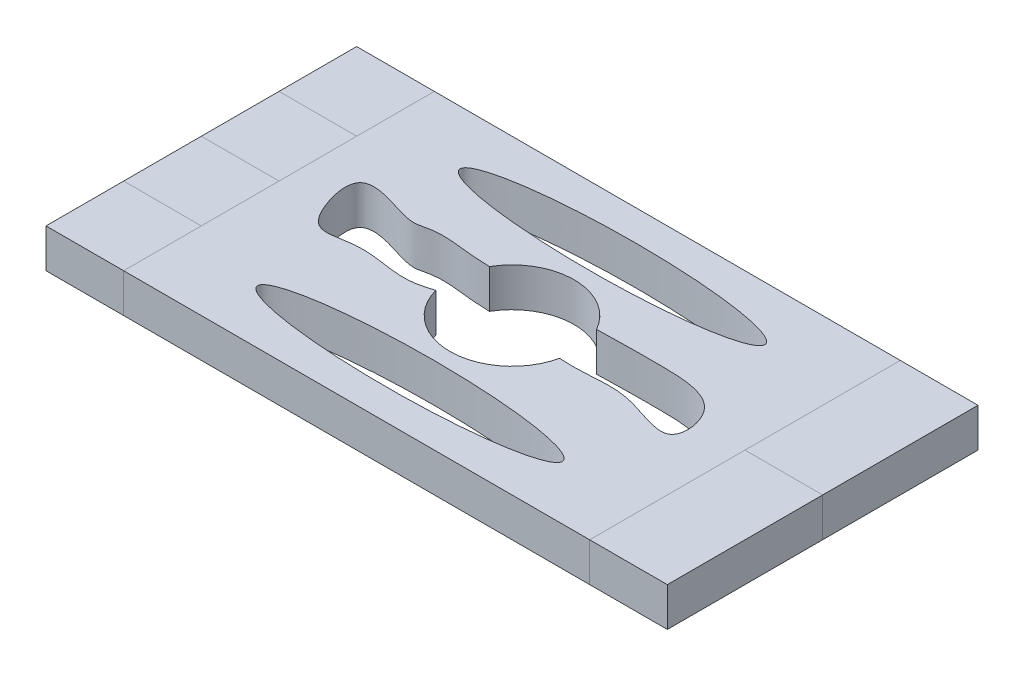
from build123d import *

# Parameters (mm, degrees)
SKETCH1_W           = 38.1
SKETCH1_H           = 25.4
SKETCH1_R           = 5.08
BOSS_EXTRUDE1_DEPTH = 3.175
SKETCH2_W           = 6.35
SKETCH2_H           = 3.175
BOSS_EXTRUDE3_DEPTH = 6.35
SKETCH2_4_W         = 6.35
SKETCH2_4_H         = 3.175
BOSS_EXTRUDE4_DEPTH = 6.35
SKETCH2_6_W         = 6.35
SKETCH2_6_H         = 3.175
BOSS_EXTRUDE6_DEPTH = 6.35
SKETCH2_7_W         = 6.35
SKETCH2_7_H         = 3.175
BOSS_EXTRUDE7_DEPTH = 6.35
SKETCH4_W           = 12.7
SKETCH4_H           = 3.175
BOSS_EXTRUDE8_DEPTH = 6.35
SKETCH4_3_W         = 12.7
SKETCH4_3_H         = 3.175
BOSS_EXTRUDE9_DEPTH = 6.35
SKETCH9_RX          = 12.451877405
SKETCH9_RY          = 1.917472524
CUT_EXTRUDE5_DEPTH  = 29.575
CUT_EXTRUDE7_DEPTH  = 29.575000056


with BuildPart() as part:
    # Sketch1 → Boss-Extrude1 (new body)
    with BuildSketch(Plane(origin=(0, 0, 0), x_dir=(1, 0, 0), z_dir=(0, 1, 0))):
        Rectangle(SKETCH1_W, SKETCH1_H)
        Circle(SKETCH1_R, mode=Mode.SUBTRACT)
    extrude(amount=BOSS_EXTRUDE1_DEPTH)

    # Sketch9 → Cut-Extrude5 (cut, through all)
    with BuildSketch(Plane(origin=(0, 3.175, 0), x_dir=(1, 0, 0), z_dir=(0, 1, 0))):
        with Locations((-0.063915751, 8.27708973)):
            Ellipse(SKETCH9_RX, SKETCH9_RY)
        with Locations((-0.063915751, -8.27708973)):
            Ellipse(SKETCH9_RX, SKETCH9_RY)
    extrude(amount=-CUT_EXTRUDE5_DEPTH, mode=Mode.SUBTRACT)

    # Sketch10 → Cut-Extrude7 (cut, through all)
    with BuildSketch(Plane(origin=(0, 3.175, 0), x_dir=(1, 0, 0), z_dir=(0, 1, 0))):
        with BuildLine():
            add(Edge.make_bspline(
                [(-6.96182969, 2.738660944), (-10.287864734, 3.13648502), (-9.323627328, 1.638842879), (-16.567532027, 4.589439003), (-15.669551346, 0.254222599), (-14.159970257, -2.122213143), (-10.589201596, -0.911393784), (-7.056662759, -2.311757431), (-1.492831629, 0.205432125), (5.198072082, -1.669226796), (10.43391419, -0.472177753), (15.835428174, -3.450211194), (14.98130854, 2.447437698), (8.620278952, 2.563645808), (7.297145439, 2.53858084), (1.131859856, 2.383363639), (-5.722900319, 2.581362483), (-6.853013941, 2.72564559), (-6.96182969, 2.738660944)],
                knots=[0, 0, 0, 0, 0.085841606, 0.139397972, 0.182102153, 0.208315478, 0.242970189, 0.308417653, 0.352476524, 0.474805738, 0.546686853, 0.622661381, 0.680218194, 0.746905199, 0.83445314, 0.971915754, 0.997191575, 1, 1, 1, 1], degree=3))
        make_face()
    extrude(amount=-CUT_EXTRUDE7_DEPTH, mode=Mode.SUBTRACT)


with BuildPart() as body_2:
    # Sketch2 → Boss-Extrude3 (new body)
    with BuildSketch(Plane.ZY.offset(19.05)):
        with Locations((-9.525, 1.5875)):
            Rectangle(SKETCH2_W, SKETCH2_H)
    extrude(amount=BOSS_EXTRUDE3_DEPTH)


with BuildPart() as body_3:
    # Sketch2<4> → Boss-Extrude4 (new body)
    with BuildSketch(Plane.ZY.offset(19.05)):
        with Locations((-3.175, 1.5875)):
            Rectangle(SKETCH2_4_W, SKETCH2_4_H)
    extrude(amount=BOSS_EXTRUDE4_DEPTH)


with BuildPart() as body_4:
    # Sketch2<6> → Boss-Extrude6 (new body)
    with BuildSketch(Plane.ZY.offset(19.05)):
        with Locations((3.175, 1.5875)):
            Rectangle(SKETCH2_6_W, SKETCH2_6_H)
    extrude(amount=BOSS_EXTRUDE6_DEPTH)


with BuildPart() as body_5:
    # Sketch2<7> → Boss-Extrude7 (new body)
    with BuildSketch(Plane.ZY.offset(19.05)):
        with Locations((9.525, 1.5875)):
            Rectangle(SKETCH2_7_W, SKETCH2_7_H)
    extrude(amount=BOSS_EXTRUDE7_DEPTH)


with BuildPart() as body_6:
    # Sketch4 → Boss-Extrude8 (new body)
    with BuildSketch(Plane(origin=(19.05, 0, 0), x_dir=(0, 0, -1), z_dir=(1, 0, 0))):
        with Locations((-6.35, 1.5875)):
            Rectangle(SKETCH4_W, SKETCH4_H)
    extrude(amount=BOSS_EXTRUDE8_DEPTH)


with BuildPart() as body_7:
    # Sketch4<3> → Boss-Extrude9 (new body)
    with BuildSketch(Plane(origin=(19.05, 0, 0), x_dir=(0, 0, -1), z_dir=(1, 0, 0))):
        with Locations((6.35, 1.5875)):
            Rectangle(SKETCH4_3_W, SKETCH4_3_H)
    extrude(amount=BOSS_EXTRUDE9_DEPTH)


solid = Compound([part.part, body_2.part, body_3.part, body_4.part, body_5.part, body_6.part, body_7.part])
